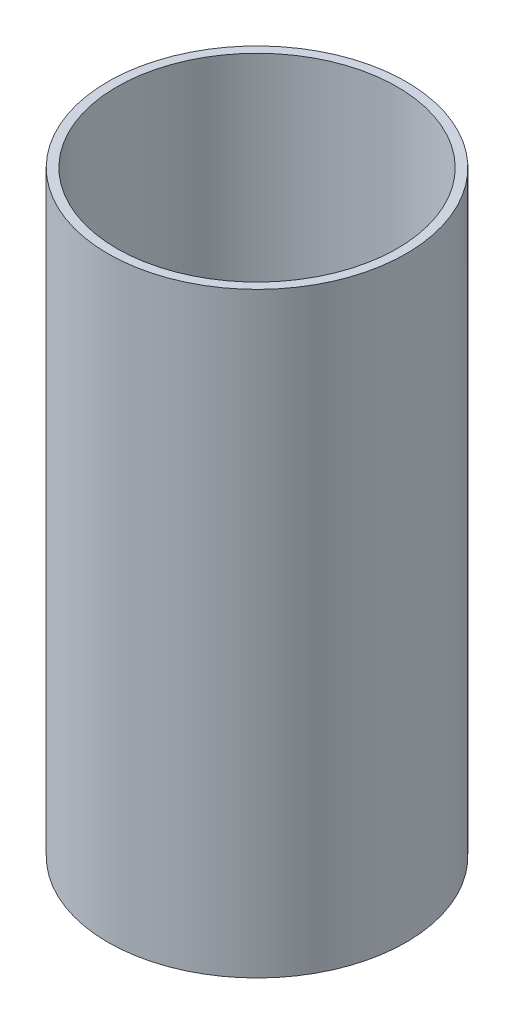
from build123d import *

# Parameters (mm, degrees)
SKETCH1_R           = 50
BOSS_EXTRUDE1_DEPTH = 200
SHELL2_T            = -3


with BuildPart() as part:
    # Sketch1 → Boss-Extrude1 (new body)
    with BuildSketch(Plane(origin=(0, 0, 0), x_dir=(1, 0, 0), z_dir=(0, 1, 0))):
        with Locations(Location((0, 0, 0), (0, 0, 270))):
            Circle(SKETCH1_R)
    extrude(amount=BOSS_EXTRUDE1_DEPTH)

    # Shell2
    shell2_openings = [part.faces().sort_by_distance(p)[0] for p in [
        (0, 200, 0),
        (0, 0, 0),
    ]]
    offset(amount=SHELL2_T, openings=shell2_openings, kind=Kind.INTERSECTION)


solid = part.part
